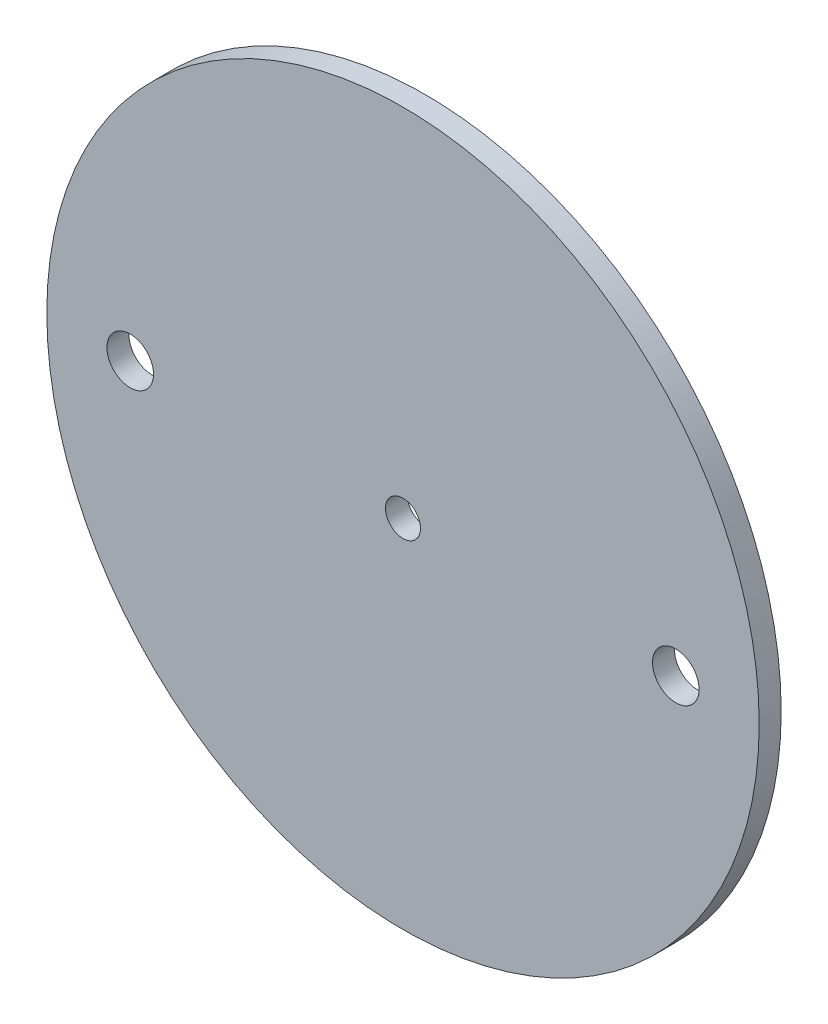
from build123d import *

# Parameters (mm, degrees)
SKETCH1_R           = 48.5394
BOSS_EXTRUDE1_DEPTH = 2.9972
SKETCH2_R           = 2.38125
SKETCH2_R_2         = 3.175
CUT_EXTRUDE1_DEPTH  = 69.710478914


with BuildPart() as part:
    # Sketch1 → Boss-Extrude1 (new body)
    with BuildSketch(Plane.XY):
        with Locations(Location((0, 0, 0), (0, 0, 180))):
            Circle(SKETCH1_R)
    extrude(amount=BOSS_EXTRUDE1_DEPTH)

    # Sketch2 → Cut-Extrude1 (cut, through all)
    with BuildSketch(Plane.XY.offset(2.9972)):
        Circle(SKETCH2_R)
        with Locations((37.1729, 0)):
            Circle(SKETCH2_R_2)
        with Locations((-37.1729, 0)):
            Circle(SKETCH2_R_2)
    extrude(amount=-CUT_EXTRUDE1_DEPTH, mode=Mode.SUBTRACT)


solid = part.part
